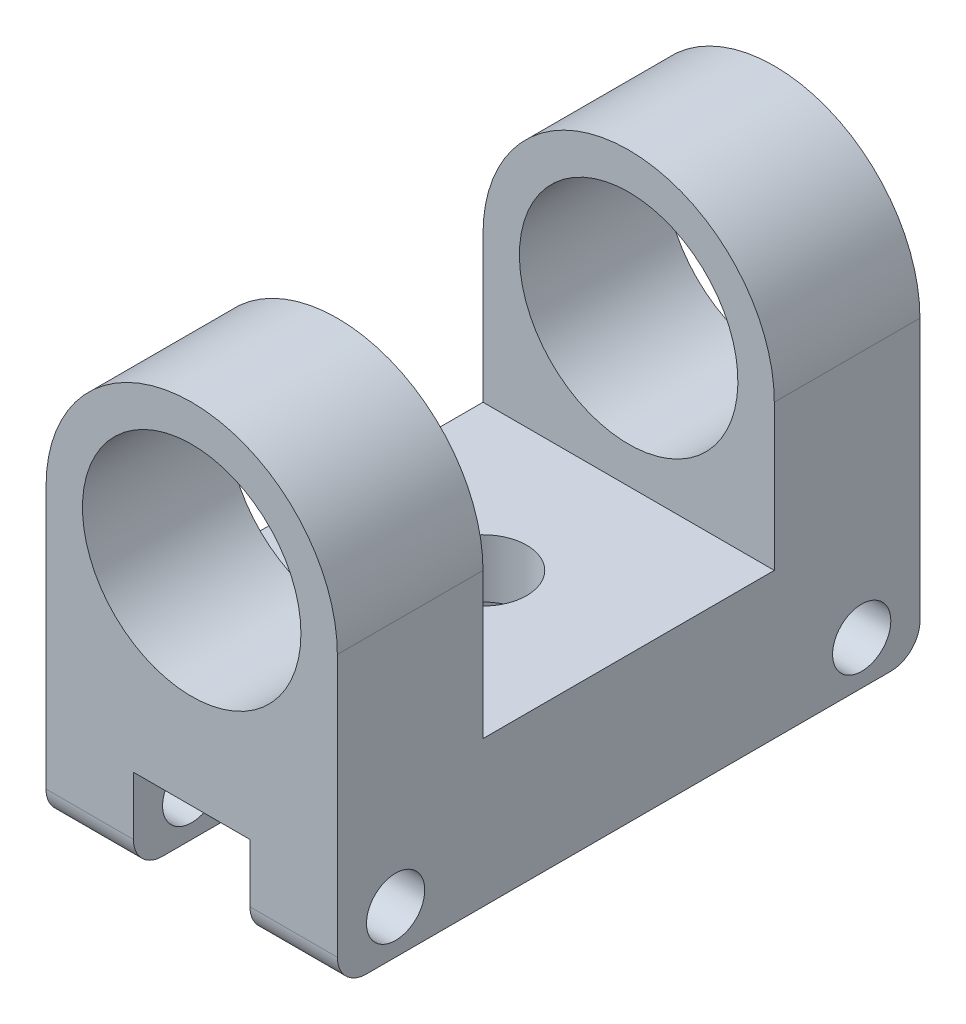
from build123d import *

# Parameters (mm, degrees)
SKETCH2_R           = 37.5
BOSS_EXTRUDE3_DEPTH = 200
SKETCH5_W           = 100
SKETCH5_H           = 100
CUT_EXTRUDE2_DEPTH  = 270.258240357
SKETCH6_R           = 10
CUT_EXTRUDE3_DEPTH  = 270.258240357
FILLET1_R           = 10
SKETCH7_R           = 15
CUT_EXTRUDE4_DEPTH  = 245.948974278


with BuildPart() as part:
    # Sketch2 → Boss-Extrude3 (new body)
    with BuildSketch(Plane.XY):
        with BuildLine():
            Line((30, 0), (30, 30))
            Line((30, 30), (70, 30))
            Line((70, 30), (70, 0))
            Line((70, 0), (100, 0))
            Line((100, 0), (100, 100))
            ThreePointArc((100, 100), (50, 150), (0, 100))
            Line((0, 100), (0, 0))
            Line((0, 0), (30, 0))
        make_face()
        with Locations((50, 100)):
            Circle(SKETCH2_R, mode=Mode.SUBTRACT)
    extrude(amount=BOSS_EXTRUDE3_DEPTH)

    # Sketch5 → Cut-Extrude2 (cut, through all)
    with BuildSketch(Plane(origin=(100, 0, 0), x_dir=(0, 0, -1), z_dir=(1, 0, 0))):
        with Locations((-100, 100)):
            Rectangle(SKETCH5_W, SKETCH5_H)
    extrude(amount=-CUT_EXTRUDE2_DEPTH, mode=Mode.SUBTRACT)

    # Sketch6 → Cut-Extrude3 (cut, through all)
    with BuildSketch(Plane(origin=(100, 0, 0), x_dir=(0, 0, -1), z_dir=(1, 0, 0))):
        with Locations((-180, 15)):
            Circle(SKETCH6_R)
        with Locations((-20, 15)):
            Circle(SKETCH6_R)
    extrude(amount=-CUT_EXTRUDE3_DEPTH, mode=Mode.SUBTRACT)

    # Fillet1
    fillet1_edges = [part.edges().sort_by_distance(p)[0] for p in [
        (15, 0, 0),
        (15, 0, 200),
        (85, 0, 200),
        (85, 0, 0),
    ]]
    fillet(fillet1_edges, radius=FILLET1_R)

    # Sketch7 → Cut-Extrude4 (cut, through all)
    with BuildSketch(Plane(origin=(0, 50, 0), x_dir=(1, 0, 0), z_dir=(0, 1, 0))):
        with Locations(Location((50, -100, 0), (0, 0, 270))):
            Circle(SKETCH7_R)
    extrude(amount=-CUT_EXTRUDE4_DEPTH, mode=Mode.SUBTRACT)


solid = part.part
